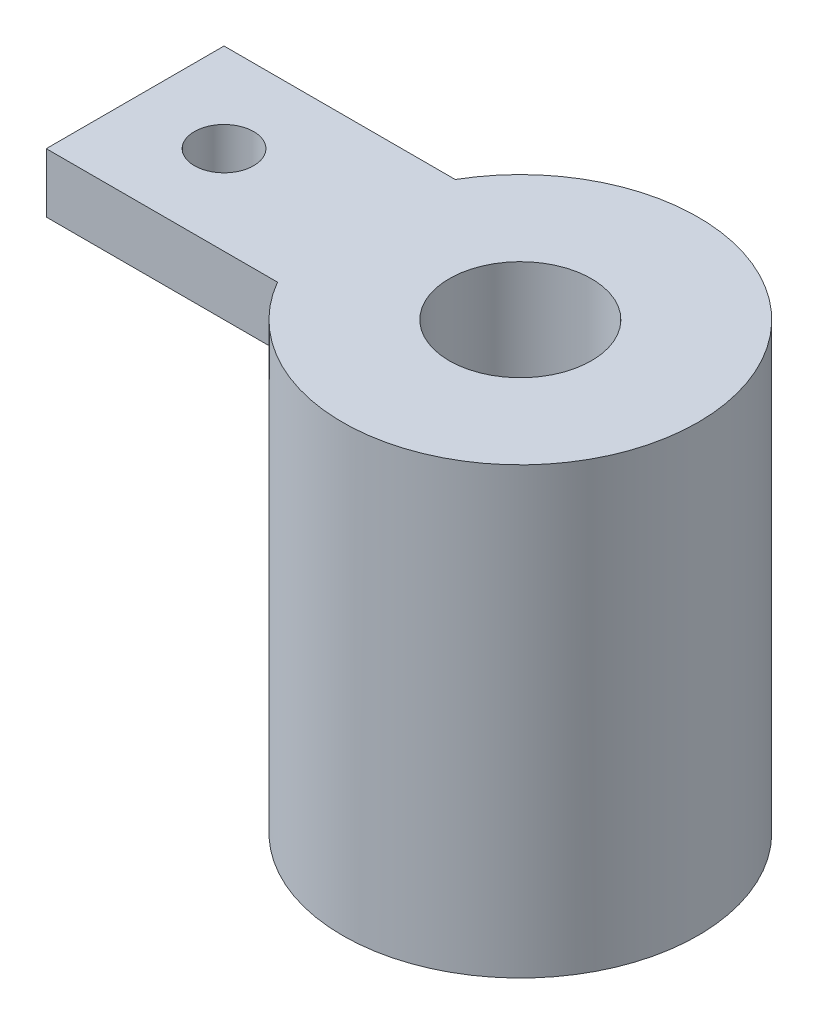
from build123d import *

# Parameters (mm, degrees)
SKETCH1_R           = 15.24
SKETCH1_R_2         = 9.525
BOSS_EXTRUDE2_DEPTH = 12.7
SKETCH3_R           = 15.24
BOSS_EXTRUDE3_DEPTH = 12.7
SKETCH4_R           = 15.24
SKETCH4_R_2         = 6.096
BOSS_EXTRUDE4_DEPTH = 12.7
SKETCH5_W           = 2.032
SKETCH5_H           = 12.7
BOSS_EXTRUDE5_DEPTH = 12.7
BOSS_EXTRUDE6_START = -5.08
BOSS_EXTRUDE6_DEPTH = 5.08
SKETCH7_R           = 2.54
CUT_EXTRUDE1_DEPTH  = 5.08


with BuildPart() as part:
    # Sketch1 → Boss-Extrude2 (new body)
    with BuildSketch(Plane(origin=(0, 0, 0), x_dir=(1, 0, 0), z_dir=(0, 1, 0))):
        with Locations(Location((0, 0, 0), (0, 0, 270))):
            Circle(SKETCH1_R)
        with Locations(Location((0, 0, 0), (0, 0, 270))):
            Circle(SKETCH1_R_2, mode=Mode.SUBTRACT)
    extrude(amount=BOSS_EXTRUDE2_DEPTH)

    # Sketch3 → Boss-Extrude3 (add)
    with BuildSketch(Plane(origin=(0, 12.7, 0), x_dir=(1, 0, 0), z_dir=(0, 1, 0))):
        with Locations(Location((0, 0, 0), (0, 0, 270))):
            Circle(SKETCH3_R)
    extrude(amount=BOSS_EXTRUDE3_DEPTH)

    # Sketch4 → Boss-Extrude4 (add)
    with BuildSketch(Plane(origin=(0, 25.4, 0), x_dir=(1, 0, 0), z_dir=(0, 1, 0))):
        with Locations(Location((0, 0, 0), (0, 0, 270))):
            Circle(SKETCH4_R)
        with Locations(Location((0, 0, 0), (0, 0, 270))):
            Circle(SKETCH4_R_2, mode=Mode.SUBTRACT)
    extrude(amount=BOSS_EXTRUDE4_DEPTH)

    # Sketch5 → Boss-Extrude5 (add)
    with BuildSketch(Plane.XZ.offset(-12.7)):
        Rectangle(SKETCH5_W, SKETCH5_H)
    extrude(amount=BOSS_EXTRUDE5_DEPTH)

    # Sketch6 → Boss-Extrude6 (add)
    with BuildSketch(Plane(origin=(0, 38.1, 0), x_dir=(1, 0, 0), z_dir=(0, 1, 0)).offset(BOSS_EXTRUDE6_START)):
        with BuildLine():
            Line((-13.198227154, 7.62), (-33.02, 7.62))
            Line((-33.02, 7.62), (-33.02, -7.62))
            Line((-33.02, -7.62), (-13.198227154, -7.62))
            ThreePointArc((-13.198227154, -7.62), (-15.24, 0), (-13.198227154, 7.62))
        make_face()
    extrude(amount=BOSS_EXTRUDE6_DEPTH)

    # Sketch7 → Cut-Extrude1 (cut)
    with BuildSketch(Plane(origin=(0, 38.1, 0), x_dir=(1, 0, 0), z_dir=(0, 1, 0))):
        with Locations(Location((-25.4, 0, 0), (0, 0, 270))):
            Circle(SKETCH7_R)
    extrude(amount=-CUT_EXTRUDE1_DEPTH, mode=Mode.SUBTRACT)


solid = part.part
